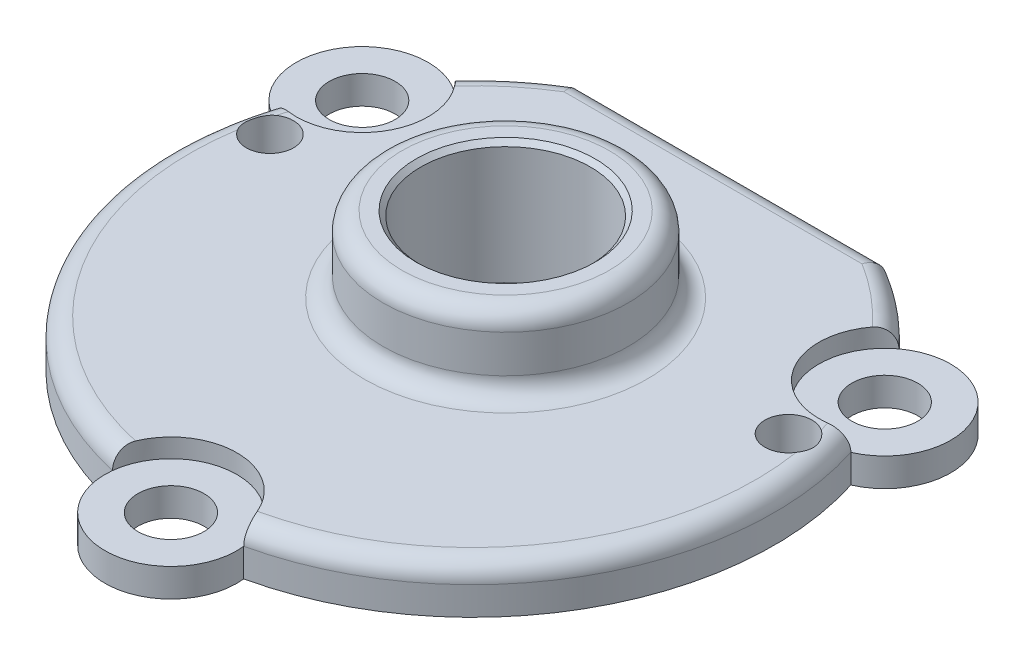
from build123d import *

# Parameters (mm, degrees)
EXTRUDE_1_DEPTH     = 5
FILLET_2_R          = 2
SKETCH_2_R          = 7
EXTRUDE_2_DEPTH     = 5
SKETCH_2_2_R        = 7
CUT_EXTRUDE_1_DEPTH = 2
SKETCH_3_R          = 3.5
CUT_EXTRUDE_2_DEPTH = 53.297030326
SKETCH_4_R          = 13
EXTRUDE_3_DEPTH     = 13
SKETCH_5_R          = 9
CUT_EXTRUDE_3_DEPTH = 54.8050126
SKETCH_6_R          = 2.5
CUT_EXTRUDE_4_DEPTH = 53.820255404
CHAMFER_1_SIZE      = 0.5
FILLET_1_R          = 2


with BuildPart() as part:
    # 草图1 → 凸台-拉伸1 (new body)
    with BuildSketch(Plane(origin=(0, 0, 0), x_dir=(1, 0, 0), z_dir=(0, 1, 0))):
        with BuildLine():
            Line((-16.363068172, 27.5), (16.363068172, 27.5))
            ThreePointArc((16.363068172, 27.5), (0, -32), (-16.363068172, 27.5))
        make_face()
    extrude(amount=EXTRUDE_1_DEPTH)

    # 圆角2
    fillet_2_edges = [part.edges().sort_by_distance(p)[0] for p in [
        (0, 5, 32),
        (0, 5, -27.5),
    ]]
    fillet(fillet_2_edges, radius=FILLET_2_R)

    # 草图2 → 凸台-拉伸2 (add)
    with BuildSketch(Plane(origin=(0, 5, 0), x_dir=(1, 0, 0), z_dir=(0, 1, 0))):
        with Locations((0, -32)):
            Circle(SKETCH_2_R)
        with Locations((-27.712812921, 16)):
            Circle(SKETCH_2_R)
        with Locations((27.712812921, 16)):
            Circle(SKETCH_2_R)
    extrude(amount=-EXTRUDE_2_DEPTH)

    # 草图2<2> → 切除-拉伸1 (cut)
    with BuildSketch(Plane(origin=(0, 5, 0), x_dir=(1, 0, 0), z_dir=(0, 1, 0))):
        with Locations((0, -32)):
            Circle(SKETCH_2_2_R)
        with Locations((-27.712812921, 16)):
            Circle(SKETCH_2_2_R)
        with Locations((27.712812921, 16)):
            Circle(SKETCH_2_2_R)
    extrude(amount=-CUT_EXTRUDE_1_DEPTH, mode=Mode.SUBTRACT)

    # 草图3 → 切除-拉伸2 (cut, through all)
    with BuildSketch(Plane(origin=(0, 3, 0), x_dir=(1, 0, 0), z_dir=(0, 1, 0))):
        with Locations((0, -32)):
            Circle(SKETCH_3_R)
        with Locations((-27.712812921, 16)):
            Circle(SKETCH_3_R)
        with Locations((27.712812921, 16)):
            Circle(SKETCH_3_R)
    extrude(amount=-CUT_EXTRUDE_2_DEPTH, mode=Mode.SUBTRACT)

    # 草图4 → 凸台-拉伸3 (add)
    with BuildSketch(Plane(origin=(0, 0, 0), x_dir=(1, 0, 0), z_dir=(0, 1, 0))):
        with Locations((0, 3.5)):
            Circle(SKETCH_4_R)
    extrude(amount=EXTRUDE_3_DEPTH)

    # 草图5 → 切除-拉伸3 (cut, through all)
    with BuildSketch(Plane(origin=(0, 13, 0), x_dir=(1, 0, 0), z_dir=(0, 1, 0))):
        with Locations((0, 3.5)):
            Circle(SKETCH_5_R)
    extrude(amount=-CUT_EXTRUDE_3_DEPTH, mode=Mode.SUBTRACT)

    # 草图6 → 切除-拉伸4 (cut, through all)
    with BuildSketch(Plane(origin=(0, 5, 0), x_dir=(1, 0, 0), z_dir=(0, 1, 0))):
        with Locations((27.5, 6)):
            Circle(SKETCH_6_R)
        with Locations((-27.5, 6)):
            Circle(SKETCH_6_R)
    extrude(amount=-CUT_EXTRUDE_4_DEPTH, mode=Mode.SUBTRACT)

    # 倒角1
    chamfer_1_edges = [part.edges().sort_by_distance(p)[0] for p in [
        (-9, 13, -3.5),
    ]]
    chamfer(chamfer_1_edges, length=CHAMFER_1_SIZE)

    # 圆角1
    fillet_1_edges = [part.edges().sort_by_distance(p)[0] for p in [
        (-13, 5, -3.5),
        (-13, 13, -3.5),
    ]]
    fillet(fillet_1_edges, radius=FILLET_1_R)


solid = part.part
